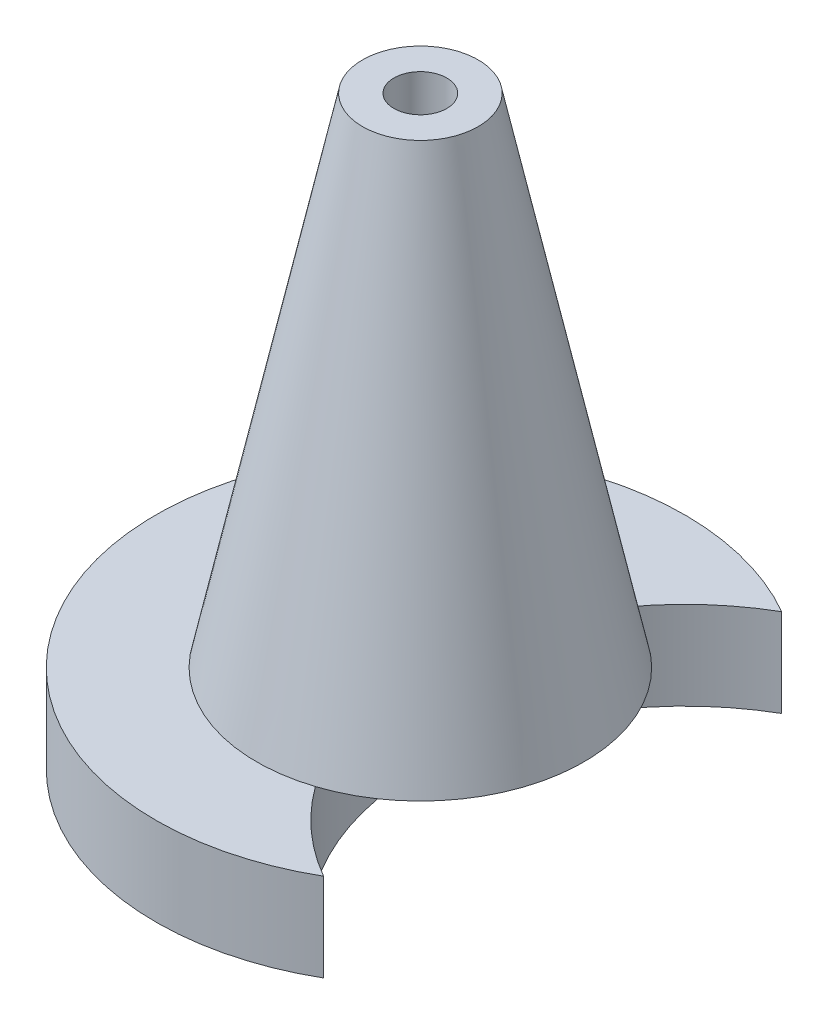
from build123d import *

# Parameters (mm, degrees)
SKETCH_2_R          = 6.56
SKETCH_1_R          = 18.55
SKETCH_3_R          = 30
EXTRUDE_2_DEPTH     = 10
SKETCH_3_5_R        = 30
CUT_EXTRUDE_2_DEPTH = 10
SKETCH_4_R          = 3
CUT_EXTRUDE_3_DEPTH = 22


with BuildPart() as part:
    # 스케치2 → 로프트1 section 0
    with BuildSketch(Plane(origin=(0, 56.41, 0), x_dir=(1, 0, 0), z_dir=(0, 1, 0))):
        Circle(SKETCH_2_R)
    # 스케치1 → 로프트1 section 1
    with BuildSketch(Plane(origin=(0, 0, 0), x_dir=(1, 0, 0), z_dir=(0, 1, 0))):
        Circle(SKETCH_1_R)
    loft()

    # 스케치3 → 보스-돌출2 (add)
    with BuildSketch(Plane(origin=(0, 0, 0), x_dir=(1, 0, 0), z_dir=(0, 1, 0))):
        with Locations(Location((0, 0, 0), (0, 0, 270))):
            Circle(SKETCH_3_R)
    extrude(amount=-EXTRUDE_2_DEPTH)

    # 스케치3<5> → 컷-돌출2 (cut)
    with BuildSketch(Plane(origin=(0, 0, 0), x_dir=(1, 0, 0), z_dir=(0, 1, 0))):
        with Locations((30, 0)):
            Circle(SKETCH_3_5_R)
    extrude(amount=-CUT_EXTRUDE_2_DEPTH, mode=Mode.SUBTRACT)

    # 스케치4 → 컷-돌출3 (cut)
    with BuildSketch(Plane(origin=(0, 56.41, 0), x_dir=(1, 0, 0), z_dir=(0, 1, 0))):
        with Locations(Location((0, 0, 0), (0, 0, 270))):
            Circle(SKETCH_4_R)
    extrude(amount=-CUT_EXTRUDE_3_DEPTH, mode=Mode.SUBTRACT)


solid = part.part
